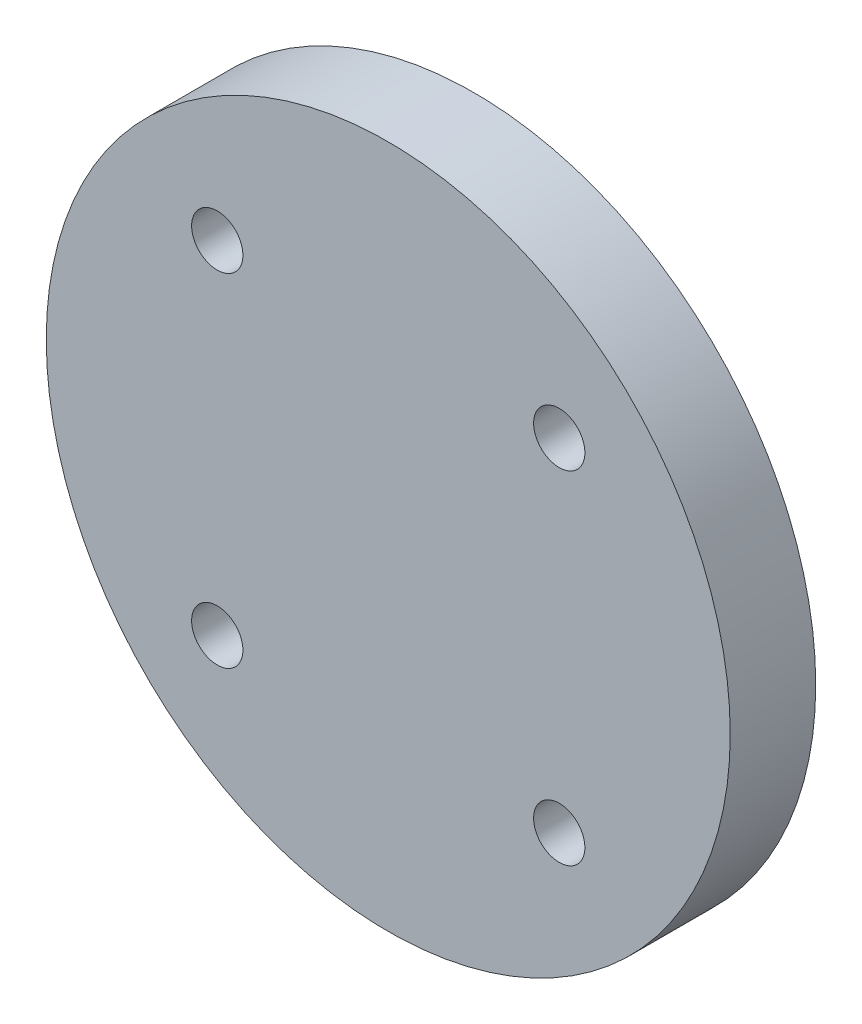
from build123d import *

# Parameters (mm, degrees)
SKETCH_1_R      = 20
SKETCH_1_R_2    = 1.5
EXTRUDE_1_DEPTH = 5


with BuildPart() as part:
    # 草圖1 → 填料-伸長1 (new body)
    with BuildSketch(Plane.XY):
        Circle(SKETCH_1_R)
        with Locations((-10, -10)):
            Circle(SKETCH_1_R_2, mode=Mode.SUBTRACT)
        with Locations(Location((-10, 10, 0), (0, 0, 180))):
            Circle(SKETCH_1_R_2, mode=Mode.SUBTRACT)
        with Locations((10, 10)):
            Circle(SKETCH_1_R_2, mode=Mode.SUBTRACT)
        with Locations(Location((10, -10, 0), (0, 0, 180))):
            Circle(SKETCH_1_R_2, mode=Mode.SUBTRACT)
    extrude(amount=EXTRUDE_1_DEPTH)


solid = part.part
